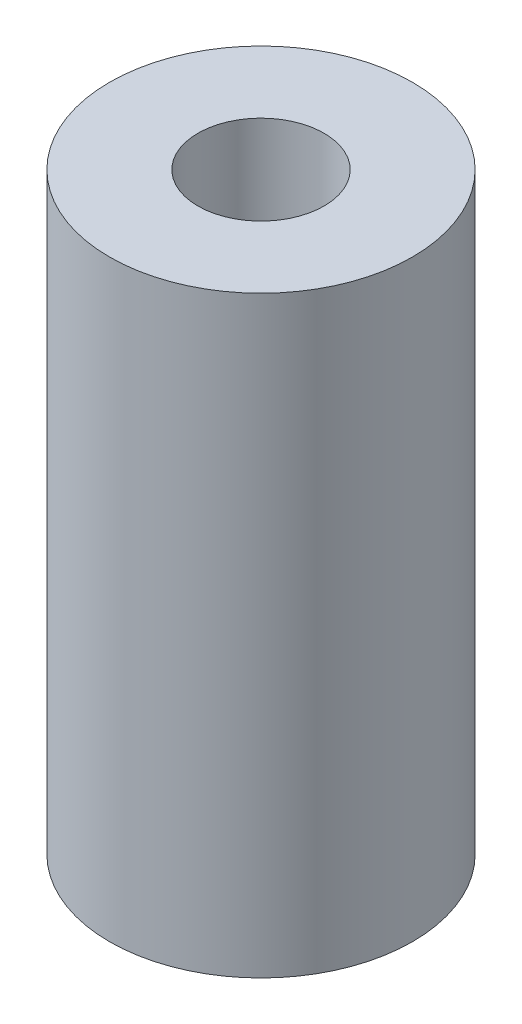
from build123d import *

# Parameters (mm, degrees)
SKETCH1_R           = 12
BOSS_EXTRUDE1_DEPTH = 47
SKETCH2_R           = 5
CUT_EXTRUDE1_DEPTH  = 50.969990995


with BuildPart() as part:
    # Sketch1 → Boss-Extrude1 (new body)
    with BuildSketch(Plane(origin=(0, 0, 0), x_dir=(1, 0, 0), z_dir=(0, 1, 0))):
        with Locations(Location((0, 0, 0), (0, 0, 270))):
            Circle(SKETCH1_R)
    extrude(amount=BOSS_EXTRUDE1_DEPTH)

    # Sketch2 → Cut-Extrude1 (cut, through all)
    with BuildSketch(Plane(origin=(0, 47, 0), x_dir=(1, 0, 0), z_dir=(0, 1, 0))):
        with Locations(Location((0, 0, 0), (0, 0, 270))):
            Circle(SKETCH2_R)
    extrude(amount=-CUT_EXTRUDE1_DEPTH, mode=Mode.SUBTRACT)


solid = part.part
